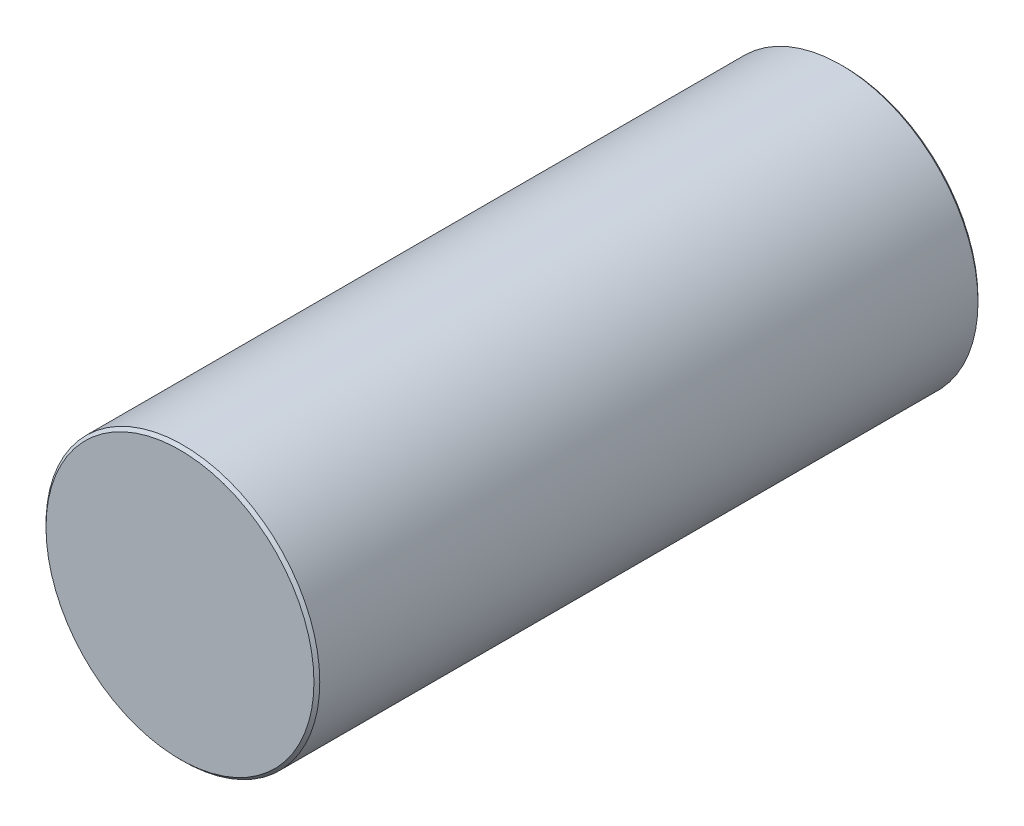
from build123d import *

# Parameters (mm, degrees)
SKETCH2_R           = 2.35
BOSS_EXTRUDE1_DEPTH = 11.4
CHAMFER2_SIZE       = 0.05


with BuildPart() as part:
    # Sketch2 → Boss-Extrude1 (new body)
    with BuildSketch(Plane.XY):
        Circle(SKETCH2_R)
    extrude(amount=BOSS_EXTRUDE1_DEPTH)

    # Chamfer2
    chamfer2_edges = [part.edges().sort_by_distance(p)[0] for p in [
        (-2.35, 0, 0),
        (-2.35, 0, 11.4),
    ]]
    chamfer(chamfer2_edges, length=CHAMFER2_SIZE)


solid = part.part
